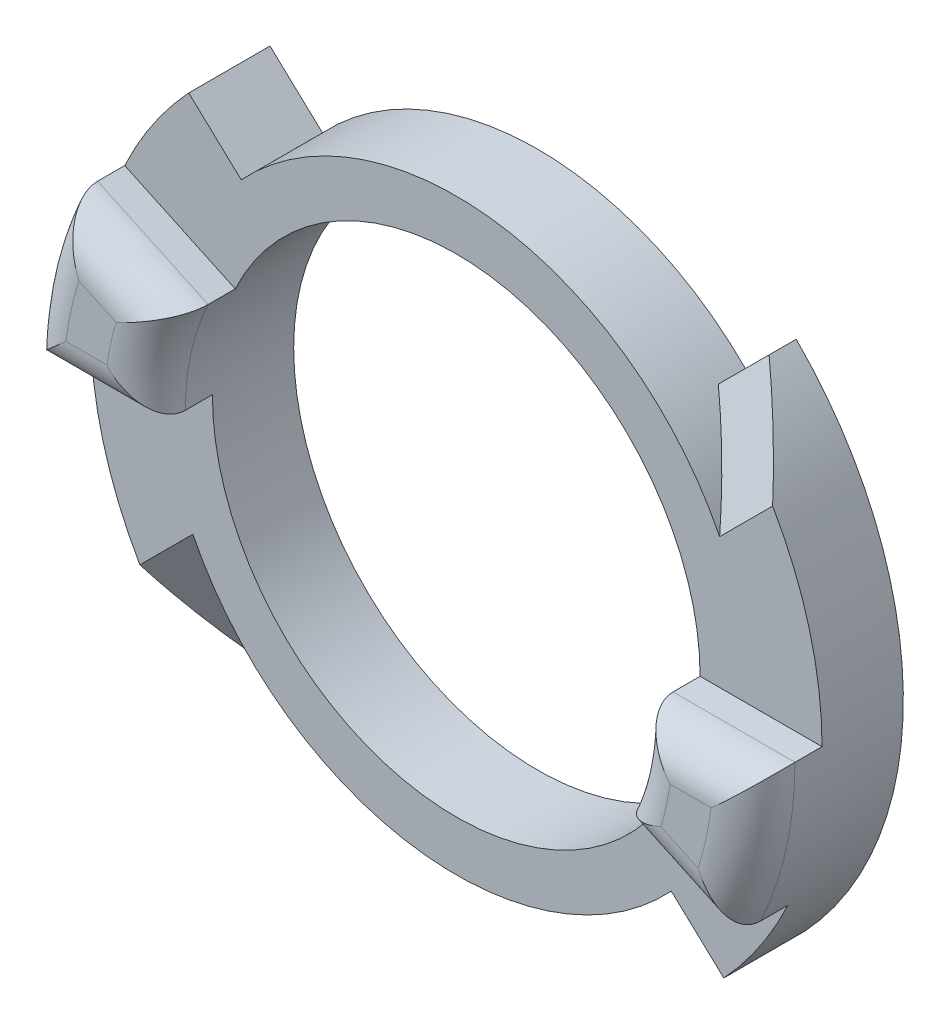
from build123d import *
from build123d.topology import SkipClean

# Parameters (mm, degrees)
BOSS_EXTRUDE1_DEPTH     = 3
BOSS_EXTRUDE2_DEPTH     = 2.5
CHAMFER1_SIZE           = 2
CHAMFER1_SIZE2          = 3.464101615
CHAMFER2_SIZE           = 2
CHAMFER2_SIZE2          = 3.464101615
CUT_EXTRUDE1_START      = -2.5
CUT_EXTRUDE1_DEPTH      = 2.5
CUT_EXTRUDE2_DEPTH      = 42.632739521
CUT_EXTRUDE2_DEPTH_BACK = 42.632739521
SKETCH4_R               = 17.222950649
SKETCH4_R_2             = 13.5
CUT_EXTRUDE3_DEPTH      = 42.409207913
CUT_EXTRUDE3_DEPTH_BACK = 42.409207913
FILLET1_R               = 1.5


with BuildPart() as part:
    # Sketch1 → Boss-Extrude1 (new body)
    with BuildSketch(Plane.XY):
        with BuildLine():
            Line((-33.222718241, -2.222718241), (-31.172108576, -0.172108576))
            ThreePointArc((-31.172108576, -0.172108576), (-34.35, 7.5), (-31.172108576, 15.172108576))
            Line((-31.172108576, 15.172108576), (-33.222718241, 17.222718241))
            ThreePointArc((-33.222718241, 17.222718241), (-37.25, 7.5), (-33.222718241, -2.222718241))
        make_face()
        with BuildLine():
            Line((-31.172108576, -0.172108576), (-29.863961031, 1.136038969))
            ThreePointArc((-29.863961031, 1.136038969), (-32.5, 7.5), (-29.863961031, 13.863961031))
            Line((-29.863961031, 13.863961031), (-31.172108576, 15.172108576))
            ThreePointArc((-31.172108576, 15.172108576), (-34.35, 7.5), (-31.172108576, -0.172108576))
        make_face()
        with BuildLine():
            ThreePointArc((-29.863961031, 13.863961031), (-26.944150891, 15.814915793), (-23.5, 16.5))
            Line((-23.5, 16.5), (-23.5, 18.35))
            ThreePointArc((-23.5, 18.35), (-27.652115241, 17.524092928), (-31.172108576, 15.172108576))
            Line((-31.172108576, 15.172108576), (-29.863961031, 13.863961031))
        make_face()
        with BuildLine():
            Line((-23.5, 18.35), (-23.5, 16.5))
            ThreePointArc((-23.5, 16.5), (-20.055849109, 15.814915793), (-17.136038969, 13.863961031))
            Line((-17.136038969, 13.863961031), (-15.827891424, 15.172108576))
            ThreePointArc((-15.827891424, 15.172108576), (-19.347884759, 17.524092928), (-23.5, 18.35))
        make_face()
        with BuildLine():
            Line((-15.827891424, 15.172108576), (-17.136038969, 13.863961031))
            ThreePointArc((-17.136038969, 13.863961031), (-15.185084207, 10.944150891), (-14.5, 7.5))
            ThreePointArc((-14.5, 7.5), (-15.185084207, 4.055849109), (-17.136038969, 1.136038969))
            Line((-17.136038969, 1.136038969), (-15.827891424, -0.172108576))
            ThreePointArc((-15.827891424, -0.172108576), (-13.475907072, 3.347884759), (-12.65, 7.5))
            ThreePointArc((-12.65, 7.5), (-13.475907072, 11.652115241), (-15.827891424, 15.172108576))
        make_face()
        with BuildLine():
            ThreePointArc((-17.136038969, 1.136038969), (-20.055849109, -0.814915793), (-23.5, -1.5))
            Line((-23.5, -1.5), (-23.5, -3.35))
            ThreePointArc((-23.5, -3.35), (-19.347884759, -2.524092928), (-15.827891424, -0.172108576))
            Line((-15.827891424, -0.172108576), (-17.136038969, 1.136038969))
        make_face()
        with BuildLine():
            Line((-23.5, -3.35), (-23.5, -1.5))
            ThreePointArc((-23.5, -1.5), (-26.944150891, -0.814915793), (-29.863961031, 1.136038969))
            Line((-29.863961031, 1.136038969), (-31.172108576, -0.172108576))
            ThreePointArc((-31.172108576, -0.172108576), (-27.652115241, -2.524092928), (-23.5, -3.35))
        make_face()
        with BuildLine():
            Line((-13.777281759, 17.222718241), (-15.827891424, 15.172108576))
            ThreePointArc((-15.827891424, 15.172108576), (-13.475907072, 11.652115241), (-12.65, 7.5))
            ThreePointArc((-12.65, 7.5), (-13.475907072, 3.347884759), (-15.827891424, -0.172108576))
            Line((-15.827891424, -0.172108576), (-13.777281759, -2.222718241))
            ThreePointArc((-13.777281759, -2.222718241), (-10.796656428, 2.238102805), (-9.75, 7.5))
            ThreePointArc((-9.75, 7.5), (-10.796656428, 12.761897195), (-13.777281759, 17.222718241))
        make_face()
    extrude(amount=BOSS_EXTRUDE1_DEPTH)

    # Sketch2 → Boss-Extrude2 (add)
    with BuildSketch(Plane.XY.offset(3)):
        with BuildLine():
            Line((-37.25, 7.5), (-32.5, 7.5))
            ThreePointArc((-32.5, 7.5), (-31.814915793, 10.944150891), (-29.863961031, 13.863961031))
            Line((-29.863961031, 13.863961031), (-31.172108576, 15.172108576))
            Line((-31.172108576, 15.172108576), (-33.222718241, 17.222718241))
            ThreePointArc((-33.222718241, 17.222718241), (-36.203343572, 12.761897195), (-37.25, 7.5))
        make_face()
        with BuildLine():
            Line((-9.75, 7.5), (-14.5, 7.5))
            ThreePointArc((-14.5, 7.5), (-15.185084207, 4.055849109), (-17.136038969, 1.136038969))
            Line((-17.136038969, 1.136038969), (-15.827891424, -0.172108576))
            Line((-15.827891424, -0.172108576), (-13.777281759, -2.222718241))
            ThreePointArc((-13.777281759, -2.222718241), (-10.796656428, 2.238102805), (-9.75, 7.5))
        make_face()
    extrude(amount=BOSS_EXTRUDE2_DEPTH)

    # Chamfer1
    chamfer1_edges = [part.edges().sort_by_distance(p)[0] for p in [
        (-32.197413409, -1.197413409, 3),
    ]]
    chamfer1_side = [part.faces().sort_by_distance(p)[0] for p in [
        (-32.197413409, -1.197413409, 1.5),
    ]]
    chamfer(chamfer1_edges, length=CHAMFER1_SIZE, length2=CHAMFER1_SIZE2, reference=chamfer1_side[0])

    # Chamfer2
    chamfer2_edges = [part.edges().sort_by_distance(p)[0] for p in [
        (-14.802586591, 16.197413409, 3),
    ]]
    chamfer2_side = [part.faces().sort_by_distance(p)[0] for p in [
        (-14.802586591, 16.197413409, 1.5),
    ]]
    chamfer(chamfer2_edges, length=CHAMFER2_SIZE, length2=CHAMFER2_SIZE2, reference=chamfer2_side[0])

    # Sketch3 → Cut-Extrude1 (cut)
    with BuildSketch(Plane.XY.offset(5.5).offset(CUT_EXTRUDE1_START)):
        with BuildLine():
            Line((-11.038267928, 1.688998901), (-15.343229917, 3.696435644))
            ThreePointArc((-15.343229917, 3.696435644), (-16.127631601, 2.337812073), (-17.136038969, 1.136038969))
            Line((-17.136038969, 1.136038969), (-13.777281759, -2.222718241))
            ThreePointArc((-13.777281759, -2.222718241), (-12.236659391, -0.386676), (-11.038267928, 1.688998901))
        make_face()
        with BuildLine():
            Line((-35.961732072, 13.311001099), (-31.656770083, 11.303564356))
            ThreePointArc((-31.656770083, 11.303564356), (-30.872368399, 12.662187927), (-29.863961031, 13.863961031))
            Line((-29.863961031, 13.863961031), (-33.222718241, 17.222718241))
            ThreePointArc((-33.222718241, 17.222718241), (-34.763340609, 15.386676), (-35.961732072, 13.311001099))
        make_face()
    extrude(amount=CUT_EXTRUDE1_DEPTH, mode=Mode.SUBTRACT)

    # Sketch4 → Cut-Extrude2 (cut, two sides: drawn at the far end of the back side and taken through both)
    with BuildSketch(Plane.XY.offset(3).offset(-CUT_EXTRUDE2_DEPTH_BACK)):
        with Locations((-23.5, 7.5)):
            Circle(SKETCH4_R)
        with Locations((-23.5, 7.5)):
            Circle(SKETCH4_R_2, mode=Mode.SUBTRACT)
    extrude(amount=CUT_EXTRUDE2_DEPTH + CUT_EXTRUDE2_DEPTH_BACK, mode=Mode.SUBTRACT)

    # Sketch5 → Cut-Extrude3 (cut, two sides: drawn at the far end of the back side and taken through both)
    with SkipClean():  # the faces are left unmerged after this step: merging them gives an invalid solid
        with BuildSketch(Plane.XY.offset(3).offset(-CUT_EXTRUDE3_DEPTH_BACK)):
            with BuildLine():
                Line((-33.373274972, 16.706977861), (-31.435187663, 14.899682207))
                ThreePointArc((-31.435187663, 14.899682207), (-31.304836834, 15.037043319), (-31.172108576, 15.172108576))
                Line((-31.172108576, 15.172108576), (-33.045941546, 17.045941546))
                ThreePointArc((-33.045941546, 17.045941546), (-33.211087305, 16.877888001), (-33.373274972, 16.706977861))
            make_face()
            with BuildLine():
                Line((-13.626725028, -1.706977861), (-15.564812337, 0.100317793))
                ThreePointArc((-15.564812337, 0.100317793), (-15.695163166, -0.037043319), (-15.827891424, -0.172108576))
                Line((-15.827891424, -0.172108576), (-13.954058454, -2.045941546))
                ThreePointArc((-13.954058454, -2.045941546), (-13.788912695, -1.877888001), (-13.626725028, -1.706977861))
            make_face()
        extrude(amount=CUT_EXTRUDE3_DEPTH + CUT_EXTRUDE3_DEPTH_BACK, mode=Mode.SUBTRACT)

    # Fillet1
    fillet1_edges = [part.edges().sort_by_distance(p)[0] for p in [
        (-13.304037396, 2.745544555, 5.5),
        (-33.695962604, 12.254455445, 5.5),
        (-10.320003904, 4.578065212, 5.5),
        (-36.679996096, 10.421934788, 5.5),
        (-34.75, 7.5, 5.5),
        (-32.286664064, 9.447956525, 5.5),
        (-12.25, 7.5, 5.5),
        (-14.713335936, 5.552043475, 5.5),
    ]]
    fillet(fillet1_edges, radius=FILLET1_R)


solid = part.part
